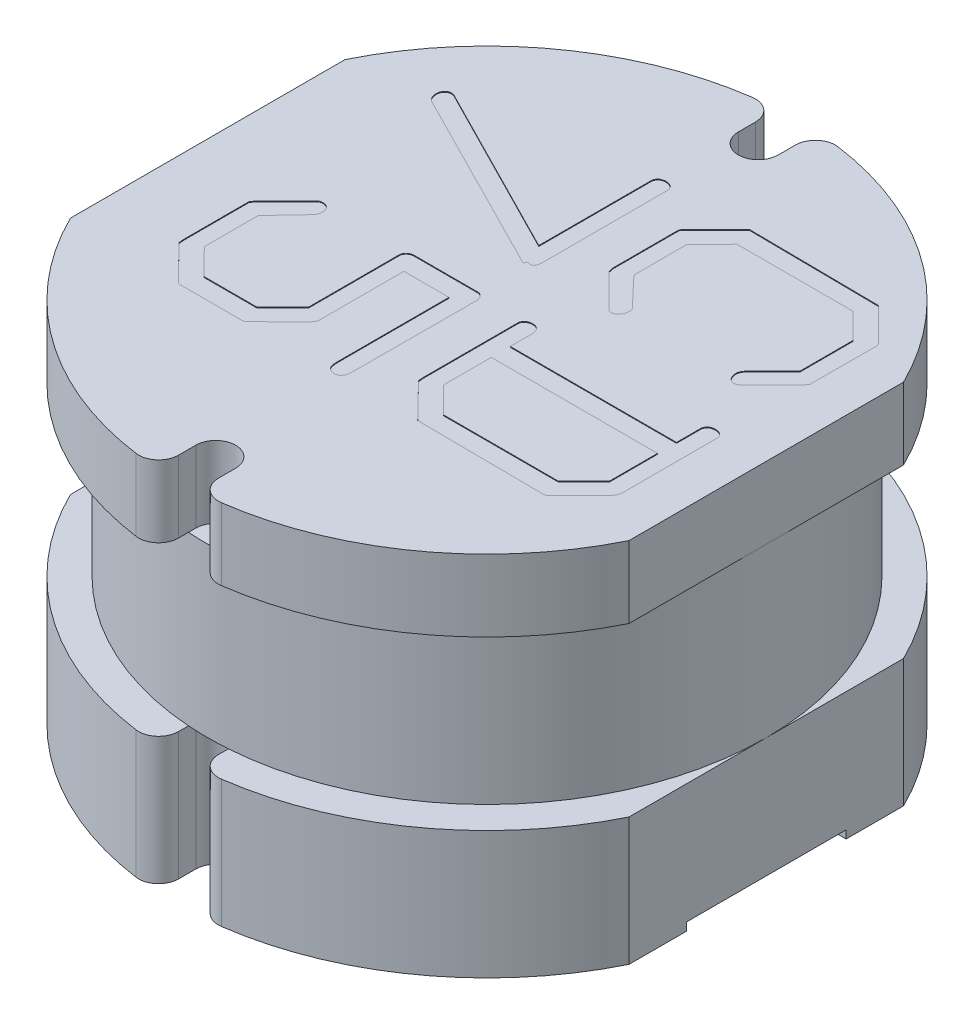
from build123d import *

# Parameters (mm, degrees)
BOSS_EXTRUDE1_DEPTH = 1.5
SKETCH2_R           = 3.5
BOSS_EXTRUDE2_DEPTH = 2.1
BOSS_EXTRUDE3_DEPTH = 0.9
BOSS_EXTRUDE4_START = 0.1
BOSS_EXTRUDE4_DEPTH = 0.1
CUT_EXTRUDE1_DEPTH  = 0.01


with BuildPart() as part:
    # Sketch1 → Boss-Extrude1 (new body)
    with BuildSketch(Plane(origin=(0, 0, 0), x_dir=(1, 0, 0), z_dir=(0, 1, 0))):
        with BuildLine():
            Line((-3.5, 1.720465053), (-3.5, -1.720465053))
            ThreePointArc((-3.5, -1.720465053), (-2.283999027, -3.161225782), (-0.534246575, -3.863234473))
            ThreePointArc((-0.534246575, -3.863234473), (-0.335777048, -3.80408745), (-0.25, -3.615591238))
            Line((-0.25, -3.615591238), (-0.25, -3.4))
            ThreePointArc((-0.25, -3.4), (0, -3.15), (0.25, -3.4))
            Line((0.25, -3.4), (0.25, -3.615591238))
            ThreePointArc((0.25, -3.615591238), (0.335777048, -3.80408745), (0.534246575, -3.863234473))
            ThreePointArc((0.534246575, -3.863234473), (2.283999027, -3.161225782), (3.5, -1.720465053))
            Line((3.5, -1.720465053), (3.5, 1.720465053))
            ThreePointArc((3.5, 1.720465053), (2.283999027, 3.161225782), (0.534246575, 3.863234473))
            ThreePointArc((0.534246575, 3.863234473), (0.335777048, 3.80408745), (0.25, 3.615591238))
            Line((0.25, 3.615591238), (0.25, 3.4))
            ThreePointArc((0.25, 3.4), (0, 3.15), (-0.25, 3.4))
            Line((-0.25, 3.4), (-0.25, 3.615591238))
            ThreePointArc((-0.25, 3.615591238), (-0.335777048, 3.80408745), (-0.534246575, 3.863234473))
            ThreePointArc((-0.534246575, 3.863234473), (-2.283999027, 3.161225782), (-3.5, 1.720465053))
        make_face()
    extrude(amount=BOSS_EXTRUDE1_DEPTH)

    # Sketch2 → Boss-Extrude2 (add)
    with BuildSketch(Plane(origin=(0, 1.5, 0), x_dir=(1, 0, 0), z_dir=(0, 1, 0))):
        with Locations(Location((0, 0, 0), (0, 0, 85.903956242))):
            Circle(SKETCH2_R)
    extrude(amount=BOSS_EXTRUDE2_DEPTH)

    # Sketch3 → Boss-Extrude3 (add)
    with BuildSketch(Plane(origin=(0, 3.6, 0), x_dir=(1, 0, 0), z_dir=(0, 1, 0))):
        with BuildLine():
            Line((-3.5, 1.720465053), (-3.5, -1.720465053))
            ThreePointArc((-3.5, -1.720465053), (-2.283999027, -3.161225782), (-0.534246575, -3.863234473))
            ThreePointArc((-0.534246575, -3.863234473), (-0.335777048, -3.80408745), (-0.25, -3.615591238))
            Line((-0.25, -3.615591238), (-0.25, -3.4))
            ThreePointArc((-0.25, -3.4), (0, -3.15), (0.25, -3.4))
            Line((0.25, -3.4), (0.25, -3.615591238))
            ThreePointArc((0.25, -3.615591238), (0.335777048, -3.80408745), (0.534246575, -3.863234473))
            ThreePointArc((0.534246575, -3.863234473), (2.283999027, -3.161225782), (3.5, -1.720465053))
            Line((3.5, -1.720465053), (3.5, 1.720465053))
            ThreePointArc((3.5, 1.720465053), (2.283999027, 3.161225782), (0.534246575, 3.863234473))
            ThreePointArc((0.534246575, 3.863234473), (0.335777048, 3.80408745), (0.25, 3.615591238))
            Line((0.25, 3.615591238), (0.25, 3.4))
            ThreePointArc((0.25, 3.4), (0, 3.15), (-0.25, 3.4))
            Line((-0.25, 3.4), (-0.25, 3.615591238))
            ThreePointArc((-0.25, 3.615591238), (-0.335777048, 3.80408745), (-0.534246575, 3.863234473))
            ThreePointArc((-0.534246575, 3.863234473), (-2.283999027, 3.161225782), (-3.5, 1.720465053))
        make_face()
    extrude(amount=BOSS_EXTRUDE3_DEPTH)

    # Sketch4 → Boss-Extrude4 (add)
    with BuildSketch(Plane.XZ.offset(BOSS_EXTRUDE4_START)):
        with BuildLine():
            Line((-3.5, 1.720465053), (-3.5, 1))
            Line((-3.5, 1), (3.5, 1))
            Line((3.5, 1), (3.5, 1.720465053))
            ThreePointArc((3.5, 1.720465053), (2.283999027, 3.161225782), (0.534246575, 3.863234473))
            ThreePointArc((0.534246575, 3.863234473), (0.335777048, 3.80408745), (0.25, 3.615591238))
            Line((0.25, 3.615591238), (0.25, 3.4))
            ThreePointArc((0.25, 3.4), (0, 3.15), (-0.25, 3.4))
            Line((-0.25, 3.4), (-0.25, 3.615591238))
            ThreePointArc((-0.25, 3.615591238), (-0.335777048, 3.80408745), (-0.534246575, 3.863234473))
            ThreePointArc((-0.534246575, 3.863234473), (-2.283999027, 3.161225782), (-3.5, 1.720465053))
        make_face()
        with BuildLine():
            Line((3.5, -1), (-3.5, -1))
            Line((-3.5, -1), (-3.5, -1.720465053))
            ThreePointArc((-3.5, -1.720465053), (-2.283999027, -3.161225782), (-0.534246575, -3.863234473))
            ThreePointArc((-0.534246575, -3.863234473), (-0.335777048, -3.80408745), (-0.25, -3.615591238))
            Line((-0.25, -3.615591238), (-0.25, -3.4))
            ThreePointArc((-0.25, -3.4), (0, -3.15), (0.25, -3.4))
            Line((0.25, -3.4), (0.25, -3.615591238))
            ThreePointArc((0.25, -3.615591238), (0.335777048, -3.80408745), (0.534246575, -3.863234473))
            ThreePointArc((0.534246575, -3.863234473), (2.283999027, -3.161225782), (3.5, -1.720465053))
            Line((3.5, -1.720465053), (3.5, -1))
        make_face()
    extrude(amount=-BOSS_EXTRUDE4_DEPTH)

    # Sketch6 → Cut-Extrude1 (cut)
    # profile 1 of 4: a face of its own
    with BuildSketch(Plane(origin=(0, 4.5, 0), x_dir=(1, 0, 0), z_dir=(0, 1, 0))):
        with BuildLine():
            Line((2.90327381, 1.060267857), (2.499162946, 0.659877232))
            add(Edge.make_bspline(
                [(2.499162946, 0.659877232), (2.490428461, 0.654543025), (2.476049018, 0.645761406), (2.459587371, 0.642540484), (2.453125, 0.641276042)],
                knots=[0, 0, 0, 0, 1.214857265, 2, 2, 2, 2], degree=3))
            add(Edge.make_bspline(
                [(2.453125, 0.641276042), (2.446070423, 0.642210707), (2.433793033, 0.643837346), (2.422234654, 0.648239098), (2.417317708, 0.650111607)],
                knots=[0, 0, 0, 0, 1.149198132, 2, 2, 2, 2], degree=3))
            add(Edge.make_bspline(
                [(2.417317708, 0.650111607), (2.409103334, 0.654524912), (2.391894608, 0.663770578), (2.373947545, 0.690361803), (2.360331641, 0.724362776), (2.355995721, 0.750554443), (2.353608631, 0.764973958)],
                knots=[0, 0, 0, 0, 0.804928788, 1.686287835, 2.726212839, 4, 4, 4, 4], degree=3))
            add(Edge.make_bspline(
                [(2.353608631, 0.764973958), (2.355018367, 0.773273999), (2.357705312, 0.789093799), (2.366120372, 0.810321859), (2.37488841, 0.829363341), (2.383733415, 0.83924103), (2.388020833, 0.844029018)],
                knots=[0, 0, 0, 0, 1.150280358, 2.192423643, 3.123817944, 4, 4, 4, 4], degree=3))
            Line((2.388020833, 0.844029018), (2.732142857, 1.19233631))
            Line((2.732142857, 1.19233631), (2.732142857, 1.857793899))
            Line((2.732142857, 1.857793899), (2.416852679, 2.172619048))
            Line((2.416852679, 2.172619048), (0.960379464, 2.172619048))
            Line((0.960379464, 2.172619048), (0.648809524, 1.858258929))
            Line((0.648809524, 1.858258929), (0.648809524, 1.19233631))
            Line((0.648809524, 1.19233631), (0.998976935, 0.822637649))
            add(Edge.make_bspline(
                [(0.998976935, 0.822637649), (1.003666257, 0.814627789), (1.013174965, 0.798385908), (1.014554018, 0.779607113), (1.015252976, 0.770089286)],
                knots=[0, 0, 0, 0, 0.986321751, 2, 2, 2, 2], degree=3))
            add(Edge.make_bspline(
                [(1.015252976, 0.770089286), (1.014966814, 0.761522625), (1.014412562, 0.744930362), (1.008005918, 0.720964019), (0.997667124, 0.698994143), (0.983854699, 0.679144704), (0.967606427, 0.662769322), (0.949782594, 0.650395547), (0.930553766, 0.643043234), (0.917189279, 0.642481947), (0.91062128, 0.642206101)],
                knots=[0, 0, 0, 0, 1.123847078, 2.176713554, 3.234303193, 4.302832359, 5.340400216, 6.250442534, 7.140177092, 8, 8, 8, 8], degree=3))
            Line((0.91062128, 0.642206101), (0.876674107, 0.649646577))
            Line((0.876674107, 0.649646577), (0.453497024, 1.078404018))
            Line((0.453497024, 1.078404018), (0.44047619, 1.1328125))
            Line((0.44047619, 1.1328125), (0.44047619, 1.963355655))
            Line((0.44047619, 1.963355655), (0.46047247, 1.994047619))
            Line((0.46047247, 1.994047619), (0.877604167, 2.410714286))
            Line((0.877604167, 2.410714286), (0.924107143, 2.410714286))
            Line((0.924107143, 2.410714286), (2.515438988, 2.393973214))
            Line((2.515438988, 2.393973214), (2.929780506, 1.974516369))
            Line((2.929780506, 1.974516369), (2.94047619, 1.942429315))
            Line((2.94047619, 1.942429315), (2.937220982, 1.107235863))
            Line((2.937220982, 1.107235863), (2.90327381, 1.060267857))
        make_face()
    # profile 2 of 4: a face of its own
    with BuildSketch(Plane(origin=(0, 4.5, 0), x_dir=(1, 0, 0), z_dir=(0, 1, 0))):
        with BuildLine():
            Line((2.898158482, -1.338820685), (2.49172247, -1.748046875))
            Line((2.49172247, -1.748046875), (2.458240327, -1.755022321))
            Line((2.458240327, -1.755022321), (0.873418899, -1.741536458))
            Line((0.873418899, -1.741536458), (0.446521577, -1.305338542))
            Line((0.446521577, -1.305338542), (0.44047619, -1.240699405))
            Line((0.44047619, -1.240699405), (0.44047619, -0.037202381))
            add(Edge.make_bspline(
                [(0.44047619, -0.037202381), (0.445439558, -0.027014419), (0.454953676, -0.007485446), (0.479309022, 0.014717605), (0.510141551, 0.027778907), (0.532727818, 0.029077076), (0.544642857, 0.029761905)],
                knots=[0, 0, 0, 0, 1.021395482, 1.95787967, 2.922710675, 4, 4, 4, 4], degree=3))
            add(Edge.make_bspline(
                [(0.544642857, 0.029761905), (0.55228465, 0.029475887), (0.567057976, 0.02892295), (0.587823523, 0.022661544), (0.606186884, 0.012666163), (0.621674038, -0.001495175), (0.63430581, -0.019999607), (0.642837784, -0.04310445), (0.647823387, -0.070627776), (0.64846552, -0.090347312), (0.648809524, -0.100911458)],
                knots=[0, 0, 0, 0, 0.962075719, 1.859911645, 2.709535321, 3.582282233, 4.48331142, 5.511760434, 6.667000706, 8, 8, 8, 8], degree=3))
            Line((0.648809524, -0.100911458), (0.648809524, -0.357142857))
            Line((0.648809524, -0.357142857), (2.732142857, -0.357142857))
            Line((2.732142857, -0.357142857), (2.732142857, -0.044642857))
            add(Edge.make_bspline(
                [(2.732142857, -0.044642857), (2.735348519, -0.034535428), (2.741539813, -0.01501432), (2.761875865, 0.008311542), (2.789187307, 0.024158938), (2.810200886, 0.02781073), (2.821428571, 0.029761905)],
                knots=[0, 0, 0, 0, 1.013349928, 1.957145876, 2.908490424, 4, 4, 4, 4], degree=3))
            add(Edge.make_bspline(
                [(2.821428571, 0.029761905), (2.82951124, 0.029522657), (2.845172249, 0.02905909), (2.867489358, 0.024705384), (2.888017442, 0.018313177), (2.906387394, 0.00870139), (2.922102691, -0.005293064), (2.933711983, -0.024738918), (2.939050184, -0.04964595), (2.939977887, -0.067568231), (2.94047619, -0.07719494)],
                knots=[0, 0, 0, 0, 1.05205527, 2.038466143, 2.951864688, 3.846535277, 4.718809578, 5.661009588, 6.743643115, 8, 8, 8, 8], degree=3))
            Line((2.94047619, -0.07719494), (2.94047619, -0.114397321))
            Line((2.94047619, -0.114397321), (2.94047619, -1.22953869))
            add(Edge.make_bspline(
                [(2.94047619, -1.22953869), (2.939974528, -1.241066016), (2.939025418, -1.262874895), (2.931107956, -1.293123605), (2.918009503, -1.319227814), (2.90475783, -1.332307157), (2.898158482, -1.338820685)],
                knots=[0, 0, 0, 0, 1.142777393, 2.162053479, 3.084700629, 4, 4, 4, 4], degree=3))
        make_face()
        Polygon((2.410342262, -1.517857143), (2.732142857, -1.192801339), (2.732142857, -0.595238095), (0.648809524, -0.595238095), (0.648809524, -1.193266369), (0.973400298, -1.517857143), align=None, mode=Mode.SUBTRACT)
    # profile 3 of 4: a face of its own
    with BuildSketch(Plane(origin=(0, 4.5, 0), x_dir=(1, 0, 0), z_dir=(0, 1, 0))):
        with BuildLine():
            add(Edge.make_bspline(
                [(-0.159040179, 0.669642857), (-0.158832588, 0.668863895), (-0.157929314, 0.665474447), (-0.162911244, 0.657900453), (-0.167712554, 0.644996183), (-0.1736855, 0.635017327), (-0.177176339, 0.629185268)],
                knots=[0, 0, 0, 0, 0.2114146, 0.919914394, 2.199869545, 4, 4, 4, 4], degree=3))
            Line((-0.177176339, 0.629185268), (-2.512555804, 1.814081101))
            add(Edge.make_bspline(
                [(-2.512555804, 1.814081101), (-2.519687159, 1.822063292), (-2.533495809, 1.83751944), (-2.54859902, 1.864002453), (-2.558053778, 1.89203703), (-2.559032996, 1.91135513), (-2.55952381, 1.921037946)],
                knots=[0, 0, 0, 0, 1.069396158, 2.070702983, 3.032977957, 4, 4, 4, 4], degree=3))
            add(Edge.make_bspline(
                [(-2.55952381, 1.921037946), (-2.559243347, 1.929610322), (-2.558721104, 1.945572743), (-2.553024266, 1.96731644), (-2.544354479, 1.985671634), (-2.535171889, 1.994426611), (-2.530691964, 1.998697917)],
                knots=[0, 0, 0, 0, 1.199454021, 2.233475629, 3.13816283, 4, 4, 4, 4], degree=3))
            add(Edge.make_bspline(
                [(-2.530691964, 1.998697917), (-2.527540038, 2.002873837), (-2.521124481, 2.011373675), (-2.506288576, 2.018714285), (-2.489435176, 2.024485662), (-2.476971226, 2.024650524), (-2.470238095, 2.024739583)],
                knots=[0, 0, 0, 0, 0.902630995, 1.837251697, 2.831665169, 4, 4, 4, 4], degree=3))
            add(Edge.make_bspline(
                [(-2.470238095, 2.024739583), (-2.464320724, 2.024283583), (-2.452053902, 2.023338286), (-2.440135091, 2.020278156), (-2.433965774, 2.018694196)],
                knots=[0, 0, 0, 0, 0.964776473, 2, 2, 2, 2], degree=3))
            Line((-2.433965774, 2.018694196), (-0.267857143, 0.916573661))
            Line((-0.267857143, 0.916573661), (-0.267857143, 2.339099702))
            add(Edge.make_bspline(
                [(-0.267857143, 2.339099702), (-0.264408118, 2.348702389), (-0.257743838, 2.367256904), (-0.237895498, 2.390113334), (-0.210409978, 2.404794484), (-0.189593685, 2.408664897), (-0.178571429, 2.410714286)],
                knots=[0, 0, 0, 0, 0.996843906, 1.926122992, 2.90187913, 4, 4, 4, 4], degree=3))
            add(Edge.make_bspline(
                [(-0.178571429, 2.410714286), (-0.17048876, 2.410475038), (-0.154827751, 2.410011471), (-0.132510642, 2.405657765), (-0.111982558, 2.399265558), (-0.093612606, 2.389653771), (-0.077897309, 2.375659317), (-0.066288017, 2.356213463), (-0.060949816, 2.331306431), (-0.060022113, 2.31338415), (-0.05952381, 2.30375744)],
                knots=[0, 0, 0, 0, 1.05205527, 2.038466143, 2.951864688, 3.846535277, 4.718809578, 5.661009588, 6.743643115, 8, 8, 8, 8], degree=3))
            Line((-0.05952381, 2.30375744), (-0.05952381, 2.26655506))
            Line((-0.05952381, 2.26655506), (-0.05952381, 0.76171875))
            add(Edge.make_bspline(
                [(-0.05952381, 0.76171875), (-0.05971652, 0.751316346), (-0.060072685, 0.732090699), (-0.064393271, 0.705928781), (-0.072038104, 0.685289549), (-0.083202498, 0.669879941), (-0.098277847, 0.660742667), (-0.116530798, 0.657345924), (-0.137379597, 0.660847695), (-0.151401496, 0.666541211), (-0.159040179, 0.669642857)],
                knots=[0, 0, 0, 0, 1.417251686, 2.619354221, 3.596458931, 4.395287101, 5.163626288, 5.938620393, 6.877026255, 8, 8, 8, 8], degree=3))
        make_face()
    # profile 4 of 4: a face of its own
    with BuildSketch(Plane(origin=(0, 4.5, 0), x_dir=(1, 0, 0), z_dir=(0, 1, 0))):
        with BuildLine():
            add(Edge.make_bspline(
                [(-0.063709077, -1.657831101), (-0.066672261, -1.6711322), (-0.072148637, -1.695714479), (-0.090861258, -1.726413087), (-0.116456013, -1.748214832), (-0.137281688, -1.753034644), (-0.147879464, -1.755487351)],
                knots=[0, 0, 0, 0, 1.174371758, 2.170402149, 3.068953704, 4, 4, 4, 4], degree=3))
            add(Edge.make_bspline(
                [(-0.147879464, -1.755487351), (-0.155968153, -1.755309354), (-0.171704159, -1.754963073), (-0.194212206, -1.749699233), (-0.214750405, -1.741022839), (-0.234294991, -1.729127527), (-0.250748684, -1.708992535), (-0.260488401, -1.679752943), (-0.2668234, -1.642458542), (-0.267489182, -1.614621943), (-0.267857143, -1.599237351)],
                knots=[0, 0, 0, 0, 0.848445739, 1.65059474, 2.409922083, 3.187037106, 4.031721707, 5.078420244, 6.385315948, 8, 8, 8, 8], degree=3))
            Line((-0.267857143, -1.599237351), (-0.267857143, -0.208333333))
            Line((-0.267857143, -0.208333333), (-0.833333333, -0.208333333))
            Line((-0.833333333, -0.208333333), (-0.833333333, -1.283482143))
            Line((-0.833333333, -1.283482143), (-0.861700149, -1.333240327))
            Line((-0.861700149, -1.333240327), (-1.278366815, -1.748046875))
            Line((-1.278366815, -1.748046875), (-1.315104167, -1.755952381))
            Line((-1.315104167, -1.755952381), (-2.097284226, -1.755952381))
            Line((-2.097284226, -1.755952381), (-2.12797619, -1.740606399))
            Line((-2.12797619, -1.740606399), (-2.553478423, -1.305338542))
            Line((-2.553478423, -1.305338542), (-2.55952381, -1.240699405))
            Line((-2.55952381, -1.240699405), (-2.55952381, -0.424107143))
            Line((-2.55952381, -0.424107143), (-2.53952753, -0.393880208))
            Line((-2.53952753, -0.393880208), (-2.131231399, 0.021391369))
            add(Edge.make_bspline(
                [(-2.131231399, 0.021391369), (-2.123846661, 0.023718525), (-2.108112908, 0.02867671), (-2.091620104, 0.029385689), (-2.082868304, 0.029761905)],
                knots=[0, 0, 0, 0, 0.938712796, 2, 2, 2, 2], degree=3))
            add(Edge.make_bspline(
                [(-2.082868304, 0.029761905), (-2.076154375, 0.02942635), (-2.064312402, 0.0288345), (-2.052923094, 0.025587589), (-2.047991071, 0.024181548)],
                knots=[0, 0, 0, 0, 1.133920638, 2, 2, 2, 2], degree=3))
            add(Edge.make_bspline(
                [(-2.047991071, 0.024181548), (-2.039621506, 0.019819768), (-2.023233427, 0.011279159), (-2.00396042, -0.009208254), (-1.990998946, -0.035119903), (-1.98721543, -0.054419811), (-1.985212054, -0.064639137)],
                knots=[0, 0, 0, 0, 0.988554768, 1.935645833, 2.906921838, 4, 4, 4, 4], degree=3))
            add(Edge.make_bspline(
                [(-1.985212054, -0.064639137), (-1.985470247, -0.075723824), (-1.98596612, -0.09701253), (-1.995048589, -0.126845342), (-2.008050407, -0.153974077), (-2.02196787, -0.16789332), (-2.028924851, -0.17485119)],
                knots=[0, 0, 0, 0, 1.083378971, 2.08068456, 3.040583703, 4, 4, 4, 4], degree=3))
            Line((-2.028924851, -0.17485119), (-2.351190476, -0.515718006))
            Line((-2.351190476, -0.515718006), (-2.351190476, -1.19140625))
            Line((-2.351190476, -1.19140625), (-2.03078497, -1.517857143))
            Line((-2.03078497, -1.517857143), (-1.362537202, -1.517857143))
            Line((-1.362537202, -1.517857143), (-1.041666667, -1.19140625))
            Line((-1.041666667, -1.19140625), (-1.041666667, -0.054873512))
            add(Edge.make_bspline(
                [(-1.041666667, -0.054873512), (-1.040470352, -0.046652971), (-1.038145941, -0.030680657), (-1.025906007, -0.009248434), (-1.008422752, 0.008934291), (-0.993274793, 0.017129812), (-0.985398065, 0.021391369)],
                knots=[0, 0, 0, 0, 0.994574724, 1.932434716, 2.924894821, 4, 4, 4, 4], degree=3))
            Line((-0.985398065, 0.021391369), (-0.95610119, 0.029761905))
            Line((-0.95610119, 0.029761905), (-0.131603423, 0.029761905))
            add(Edge.make_bspline(
                [(-0.131603423, 0.029761905), (-0.123253437, 0.02653149), (-0.106536934, 0.020064266), (-0.08606492, 0.000952151), (-0.069264535, -0.023715622), (-0.06289647, -0.043477269), (-0.05952381, -0.053943452)],
                knots=[0, 0, 0, 0, 0.92405125, 1.849931888, 2.861278796, 4, 4, 4, 4], degree=3))
            Line((-0.05952381, -0.053943452), (-0.063709077, -1.657831101))
        make_face()
    extrude(amount=-CUT_EXTRUDE1_DEPTH, mode=Mode.SUBTRACT)


solid = part.part
